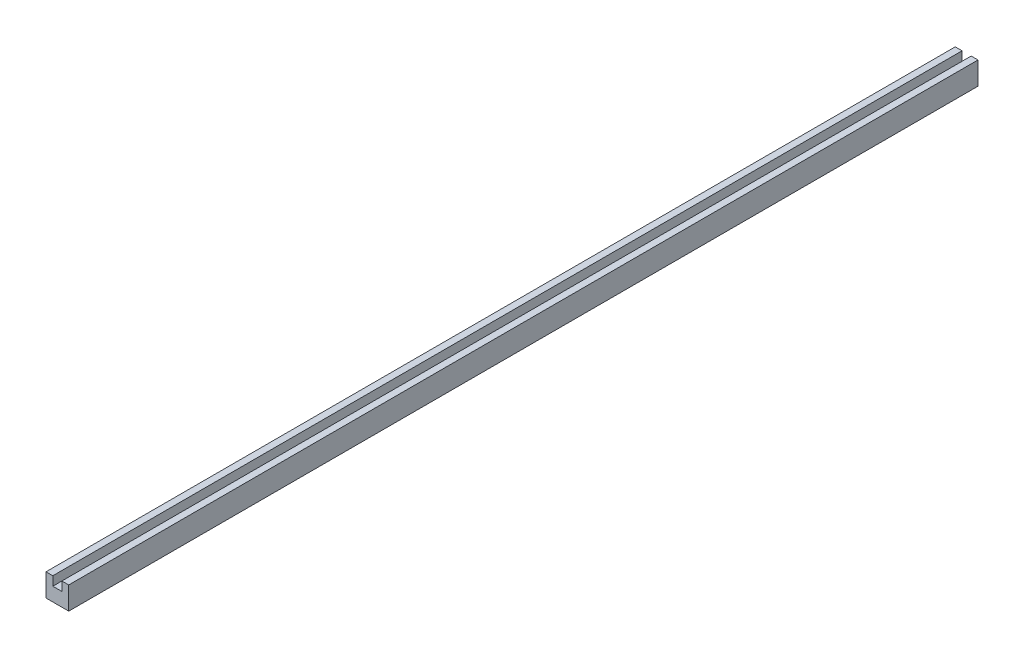
from build123d import *

# Parameters (mm, degrees)
BOSS_EXTRUDE1_DEPTH = 2000


with BuildPart() as part:
    # Sketch1 → Boss-Extrude1 (new body)
    with BuildSketch(Plane.XY):
        Polygon((-5.714285714, 14.973544974), (-20.714285714, 14.973544974), (-20.714285714, -35.026455026), (29.285714286, -35.026455026), (29.285714286, 14.973544974), (14.285714286, 14.973544974), (14.285714286, -5.026455026), (-5.714285714, -5.026455026), align=None)
    extrude(amount=-BOSS_EXTRUDE1_DEPTH)


solid = part.part
